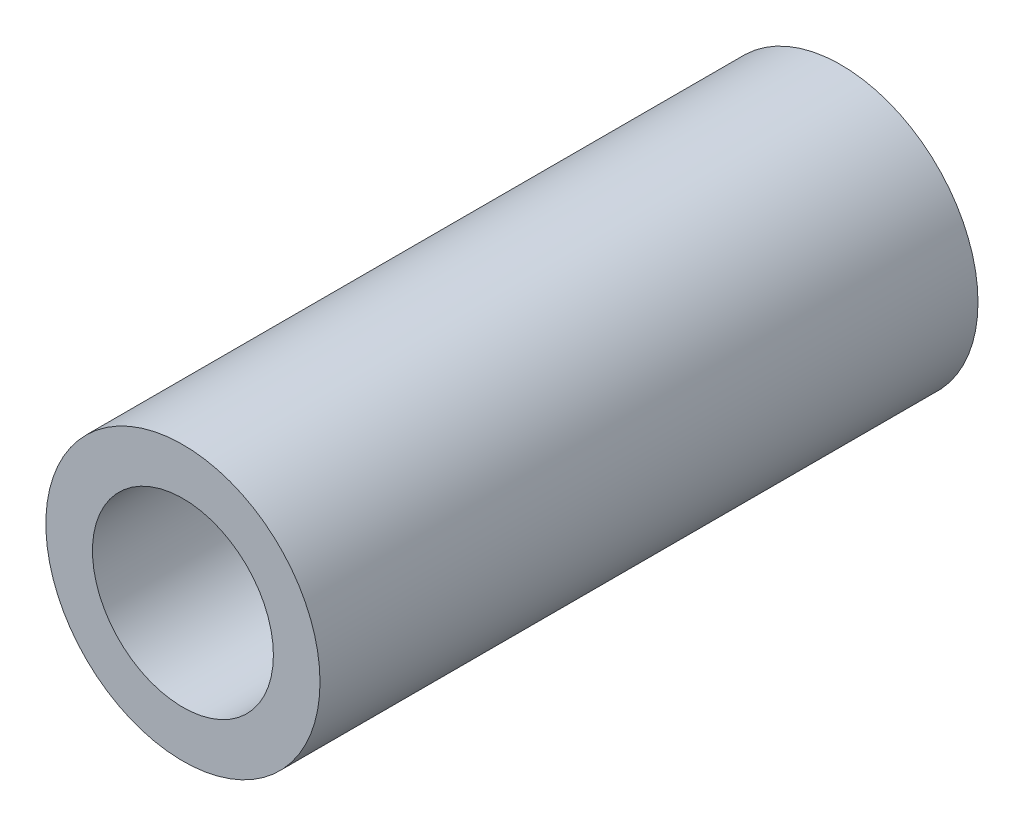
from build123d import *

# Parameters (mm, degrees)
ESQUISSE1_R        = 2.5
BOSS_EXTRU_1_DEPTH = 12
TROU_TARAUD_M41_D  = 3.3


with BuildPart() as part:
    # Esquisse1 → Boss.-Extru.1 (new body)
    with BuildSketch(Plane.XY):
        Circle(ESQUISSE1_R)
    extrude(amount=BOSS_EXTRU_1_DEPTH)

    # Trou taraudé M41 (through all)
    with Locations(Plane.XY.offset(12)):
        with Locations((0, 0)):
            Hole(TROU_TARAUD_M41_D / 2)


solid = part.part
